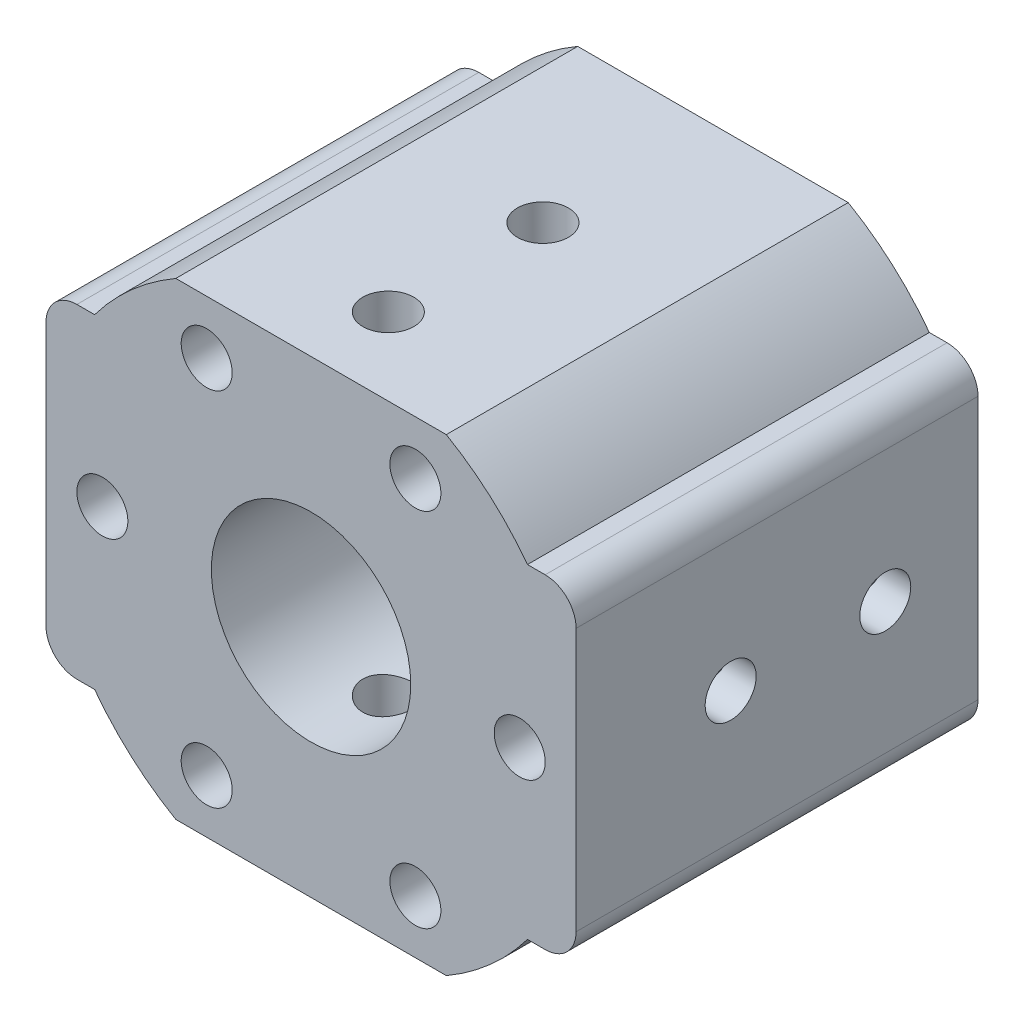
from build123d import *
from build123d.topology import SkipClean

# Parameters (mm, degrees)
EXTRUDE_1_DEPTH      = 30
SKETCH_3_R           = 6.45
CUT_EXTRUDE_1_DEPTH  = 38.893765978
SKETCH_4_R           = 1.65
CUT_EXTRUDE_2_DEPTH  = 47.097722286
CUT_EXTRUDE_START    = -14
SKETCH_7_W           = 30
SKETCH_7_H           = 7
CUT_EXTRUDE_4_DEPTH  = 30
CUT_EXTRUDE_START_2  = 14
SKETCH_7_2_W         = 30
SKETCH_7_2_H         = 7
CUT_EXTRUDE_5_DEPTH  = 30
SKETCH_10_W          = 30
SKETCH_10_H          = 7
EXTRUDE_2_DEPTH      = 3.146428
SKETCH_11_W          = 30
SKETCH_11_H          = 7
EXTRUDE_3_DEPTH      = 3.146428
SKETCH_12_R          = 1.65
CUT_EXTRUDE_6_DEPTH  = 49.270720898
SKETCH_14_W          = 2.981852414
SKETCH_14_H          = 30.826717304
SKETCH_14_W_2        = 3.229128589
SKETCH_14_H_2        = 31.791094385
CUT_EXTRUDE_7_DEPTH  = 47.097722467
SKETCH_17_R          = 1.65
CUT_EXTRUDE_9_DEPTH  = 49.017575073
CUT_EXTRUDE_10_DEPTH = 5
SKETCH_19_R          = 1.65
CUT_EXTRUDE_11_DEPTH = 34.892292803
FILLET_1_R           = 2
EXTRUDE_START        = 1
EXTRUDE_6_DEPTH      = 1


with BuildPart() as part:
    # 草图1 → 凸台-拉伸1 (new body)
    with BuildSketch(Plane.XY):
        with BuildLine():
            Line((8.75, 15.155444566), (-8.75, 15.155444566))
            ThreePointArc((-8.75, 15.155444566), (-17.5, 0), (-8.75, -15.155444566))
            Line((-8.75, -15.155444566), (8.75, -15.155444566))
            ThreePointArc((8.75, -15.155444566), (17.5, 0), (8.75, 15.155444566))
        make_face()
    extrude(amount=EXTRUDE_1_DEPTH)

    # 草图3 → 切除-拉伸1 (cut, through all)
    with BuildSketch(Plane.XY.offset(30)):
        Circle(SKETCH_3_R)
    extrude(amount=-CUT_EXTRUDE_1_DEPTH, mode=Mode.SUBTRACT)

    # 草图4 → 切除-拉伸2 (cut, through all)
    with BuildSketch(Plane(origin=(0, 15.155444566, 0), x_dir=(1, 0, 0), z_dir=(0, 1, 0))):
        with Locations(Location((0, -15, 0), (0, 0, 180))):
            Circle(SKETCH_4_R)
        with Locations(Location((0, -25, 0), (0, 0, 180))):
            Circle(SKETCH_4_R)
    extrude(amount=-CUT_EXTRUDE_2_DEPTH, mode=Mode.SUBTRACT)

    # 草图7 → 切除-拉伸4 (cut)
    with BuildSketch(Plane(origin=(0, 0, 0), x_dir=(0, 0, -1), z_dir=(1, 0, 0)).offset(CUT_EXTRUDE_START)):
        with Locations((-15, 7)):
            Rectangle(SKETCH_7_W, SKETCH_7_H)
        with Locations((-15, -7)):
            Rectangle(SKETCH_7_W, SKETCH_7_H)
    extrude(amount=-CUT_EXTRUDE_4_DEPTH, mode=Mode.SUBTRACT)

    # 草图7<2> → 切除-拉伸5 (cut)
    with BuildSketch(Plane(origin=(0, 0, 0), x_dir=(0, 0, -1), z_dir=(1, 0, 0)).offset(CUT_EXTRUDE_START_2)):
        with Locations((-15, 7)):
            Rectangle(SKETCH_7_2_W, SKETCH_7_2_H)
        with Locations((-15, -7)):
            Rectangle(SKETCH_7_2_W, SKETCH_7_2_H)
    extrude(amount=CUT_EXTRUDE_5_DEPTH, mode=Mode.SUBTRACT)

    # 草图10 → 凸台-拉伸2 (add)
    with BuildSketch(Plane.ZY.offset(14)):
        with Locations((15, -7)):
            Rectangle(SKETCH_10_W, SKETCH_10_H)
        with Locations((15, 7)):
            Rectangle(SKETCH_10_W, SKETCH_10_H)
    extrude(amount=EXTRUDE_2_DEPTH)

    # 草图11 → 凸台-拉伸3 (add)
    with BuildSketch(Plane(origin=(14, 0, 0), x_dir=(0, 0, -1), z_dir=(1, 0, 0))):
        with Locations((-15, -7)):
            Rectangle(SKETCH_11_W, SKETCH_11_H)
        with Locations((-15, 7)):
            Rectangle(SKETCH_11_W, SKETCH_11_H)
    extrude(amount=EXTRUDE_3_DEPTH)

    # 草图12 → 切除-拉伸6 (cut, through all)
    with BuildSketch(Plane.ZY.offset(17.146428199)):
        with Locations((20, 0)):
            Circle(SKETCH_12_R)
    extrude(amount=-CUT_EXTRUDE_6_DEPTH, mode=Mode.SUBTRACT)

    # 草图14 → 切除-拉伸7 (cut, through all)
    with SkipClean():  # the faces are left unmerged after this step: merging them gives an invalid solid
        with BuildSketch(Plane.XZ.offset(15.155444566)):
            with Locations((-18.637354406, 14.586641348)):
                Rectangle(SKETCH_14_W, SKETCH_14_H)
            with Locations((18.760992494, 14.104452808)):
                Rectangle(SKETCH_14_W_2, SKETCH_14_H_2)
        extrude(amount=-CUT_EXTRUDE_7_DEPTH, mode=Mode.SUBTRACT)

    # 草图17 → 切除-拉伸9 (cut, through all)
    with SkipClean():  # the faces are left unmerged after this step: merging them gives an invalid solid
        with BuildSketch(Plane(origin=(17.146428199, 0, 0), x_dir=(0, 0, -1), z_dir=(1, 0, 0))):
            with Locations((-10, 0)):
                Circle(SKETCH_17_R)
        extrude(amount=-CUT_EXTRUDE_9_DEPTH, mode=Mode.SUBTRACT)

    # 草图18 → 切除-拉伸10 (cut)
    with BuildSketch(Plane(origin=(0, 0, 0), x_dir=(-1, 0, 0), z_dir=(0, 0, -1))):
        with BuildLine():
            Line((-14, 10.5), (-17.146428199, 10.5))
            Line((-17.146428199, 10.5), (-17.146428199, -10.5))
            Line((-17.146428199, -10.5), (-14, -10.5))
            ThreePointArc((-14, -10.5), (-11.610724182, -13.093551236), (-8.75, -15.155444566))
            Line((-8.75, -15.155444566), (8.75, -15.155444566))
            ThreePointArc((8.75, -15.155444566), (11.610724182, -13.093551236), (14, -10.5))
            Line((14, -10.5), (17.146428199, -10.5))
            Line((17.146428199, -10.5), (17.146428199, 10.5))
            Line((17.146428199, 10.5), (14, 10.5))
            ThreePointArc((14, 10.5), (11.610724182, 13.093551236), (8.75, 15.155444566))
            Line((8.75, 15.155444566), (-8.75, 15.155444566))
            ThreePointArc((-8.75, 15.155444566), (-11.610724182, 13.093551236), (-14, 10.5))
        make_face()
    extrude(amount=-CUT_EXTRUDE_10_DEPTH, mode=Mode.SUBTRACT)

    # 草图19 → 切除-拉伸11 (cut, through all)
    with BuildSketch(Plane.XY.offset(30)):
        with Locations((13.5, 0)):
            Circle(SKETCH_19_R)
        with Locations((6.75, -11.691342951)):
            Circle(SKETCH_19_R)
        with Locations((-6.75, -11.691342951)):
            Circle(SKETCH_19_R)
        with Locations((-13.5, 0)):
            Circle(SKETCH_19_R)
        with Locations((-6.75, 11.691342951)):
            Circle(SKETCH_19_R)
        with Locations((6.75, 11.691342951)):
            Circle(SKETCH_19_R)
    extrude(amount=-CUT_EXTRUDE_11_DEPTH, mode=Mode.SUBTRACT)

    # 圆角1
    fillet_1_edges = [part.edges().sort_by_distance(p)[0] for p in [
        (-17.146428, 10.5, 17.5),
        (17.146428, -10.5, 17.5),
        (17.146428, 10.5, 17.5),
        (-17.146428, -10.5, 17.5),
    ]]
    fillet(fillet_1_edges, radius=FILLET_1_R)

    # 草图24 → 凸台-拉伸6 (add)
    with BuildSketch(Plane(origin=(0, 0, 5), x_dir=(-1, 0, 0), z_dir=(0, 0, -1)).offset(EXTRUDE_START)):
        with BuildLine():
            Line((-17.146428199, 8.5), (-17.146428199, -8.5))
            ThreePointArc((-17.146428199, -8.5), (-16.560641762, -9.914213562), (-15.146428199, -10.5))
            Line((-15.146428199, -10.5), (-14, -10.5))
            ThreePointArc((-14, -10.5), (-11.610724182, -13.093551236), (-8.75, -15.155444566))
            Line((-8.75, -15.155444566), (8.75, -15.155444566))
            ThreePointArc((8.75, -15.155444566), (11.610724182, -13.093551236), (14, -10.5))
            Line((14, -10.5), (15.146428199, -10.5))
            ThreePointArc((15.146428199, -10.5), (16.560641762, -9.914213562), (17.146428199, -8.5))
            Line((17.146428199, -8.5), (17.146428199, 8.5))
            ThreePointArc((17.146428199, 8.5), (16.560641762, 9.914213562), (15.146428199, 10.5))
            Line((15.146428199, 10.5), (14, 10.5))
            ThreePointArc((14, 10.5), (11.610724182, 13.093551236), (8.75, 15.155444566))
            Line((8.75, 15.155444566), (-8.75, 15.155444566))
            ThreePointArc((-8.75, 15.155444566), (-11.610724182, 13.093551236), (-14, 10.5))
            Line((-14, 10.5), (-15.146428199, 10.5))
            ThreePointArc((-15.146428199, 10.5), (-16.560641762, 9.914213562), (-17.146428199, 8.5))
        make_face()
    extrude(amount=-EXTRUDE_6_DEPTH)


solid = part.part
